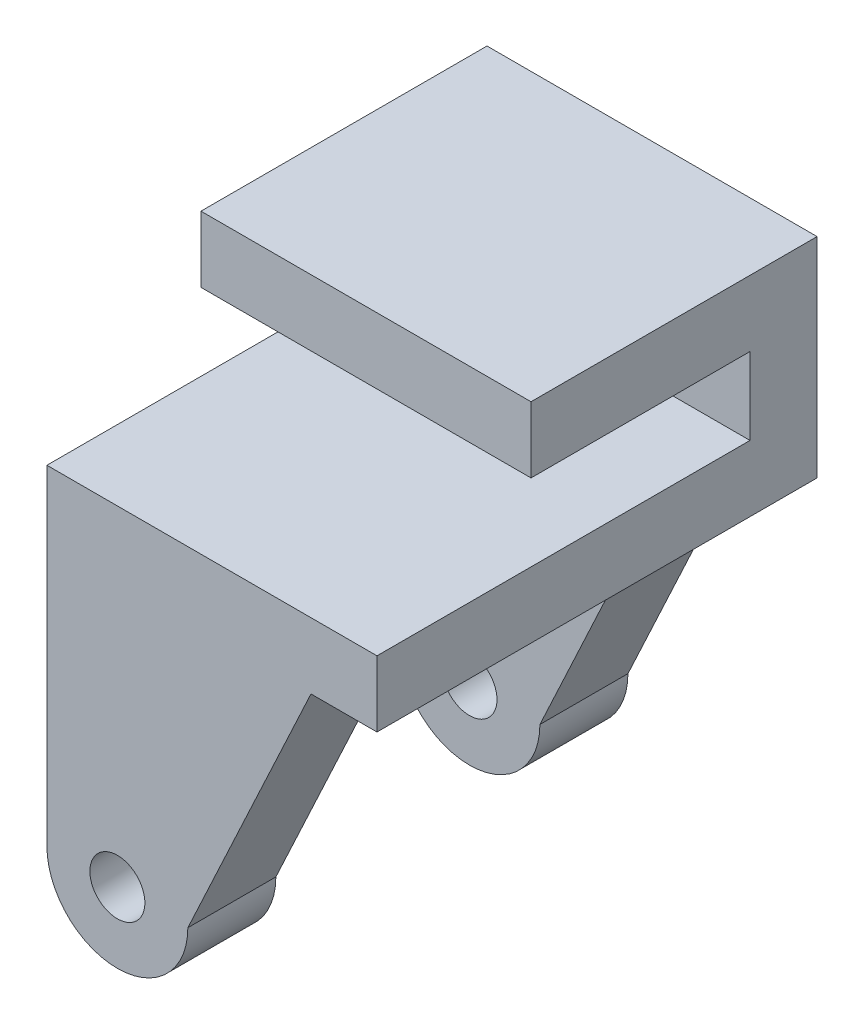
from build123d import *

# Parameters (mm, degrees)
SKETCH1_W               = 20
SKETCH1_H               = 9.5
BOSS_EXTRUDE1_DEPTH     = 15
CUT_EXTRUDE1_DEPTH      = 27.744158241
SKETCH4_R               = 1.25
BOSS_EXTRUDE3_DEPTH     = 4
MIRROR2_COPY_1_SKETCH_R = 1.25
MIRROR2_COPY_1_DEPTH    = 4
SKETCH5_W               = 15.5626007
SKETCH5_H               = 25.548288799
CUT_EXTRUDE2_DEPTH      = 30.25928037


with BuildPart() as part:
    # Sketch1 → Boss-Extrude1 (new body)
    with BuildSketch(Plane(origin=(0, 0, 0), x_dir=(0, 0, -1), z_dir=(1, 0, 0))):
        with Locations((10, 4.75)):
            Rectangle(SKETCH1_W, SKETCH1_H)
    boss_extrude1 = extrude(amount=BOSS_EXTRUDE1_DEPTH)

    # Sketch2 → Cut-Extrude1 (cut, symmetric)
    with BuildSketch(Plane(origin=(15, 0, 0), x_dir=(0, 0, -1), z_dir=(1, 0, 0))):
        Polygon((20, 3), (3.047520991, 3), (3.047520991, 6.5), (13, 6.5), (13, 9.5), (20, 9.5), (20, 6.3375), align=None)
    cut_extrude1 = extrude(amount=CUT_EXTRUDE1_DEPTH, both=True, mode=Mode.SUBTRACT)

    # Sketch4 → Boss-Extrude3 (add)
    with BuildSketch(Plane.XY):
        with BuildLine():
            Line((0, 0), (0, -12))
            ThreePointArc((0, -12), (3.202154051, -15.202154051), (6.404308102, -12))
            Line((6.404308102, -12), (12, 0))
            Line((12, 0), (0, 0))
        make_face()
        with Locations((3.202154051, -12)):
            Circle(SKETCH4_R, mode=Mode.SUBTRACT)
    boss_extrude3 = extrude(amount=-BOSS_EXTRUDE3_DEPTH)

    # Mirror1: Boss-Extrude3 across plane
    add(boss_extrude3.mirror(Plane.XY.offset(-10)))

    # Mirror2: Boss-Extrude1, Cut-Extrude1, Boss-Extrude3 across plane
    add(boss_extrude1.mirror(Plane(origin=(15, 0, -20), x_dir=(1, 0, 0), z_dir=(0, 0, 1))))
    add(cut_extrude1.mirror(Plane(origin=(15, 0, -20), x_dir=(1, 0, 0), z_dir=(0, 0, 1))), mode=Mode.SUBTRACT)
    add(boss_extrude3.mirror(Plane(origin=(15, 0, -20), x_dir=(1, 0, 0), z_dir=(0, 0, 1))))

    # Mirror2 copy 1 sketch → Mirror2 copy 1 (add)
    with BuildSketch(Plane.XY.offset(-20)):
        with BuildLine():
            Line((0, 0), (0, -12))
            ThreePointArc((0, -12), (3.202154051, -15.202154051), (6.404308102, -12))
            Line((6.404308102, -12), (12, 0))
            Line((12, 0), (0, 0))
        make_face()
        with Locations((3.202154051, -12)):
            Circle(MIRROR2_COPY_1_SKETCH_R, mode=Mode.SUBTRACT)
    extrude(amount=-MIRROR2_COPY_1_DEPTH)

    # Sketch5 → Cut-Extrude2 (cut, through all)
    with BuildSketch(Plane.XY.offset(-20)):
        with Locations((7.481159079, -2.907599789)):
            Rectangle(SKETCH5_W, SKETCH5_H)
    extrude(amount=CUT_EXTRUDE2_DEPTH, mode=Mode.SUBTRACT)


solid = part.part
